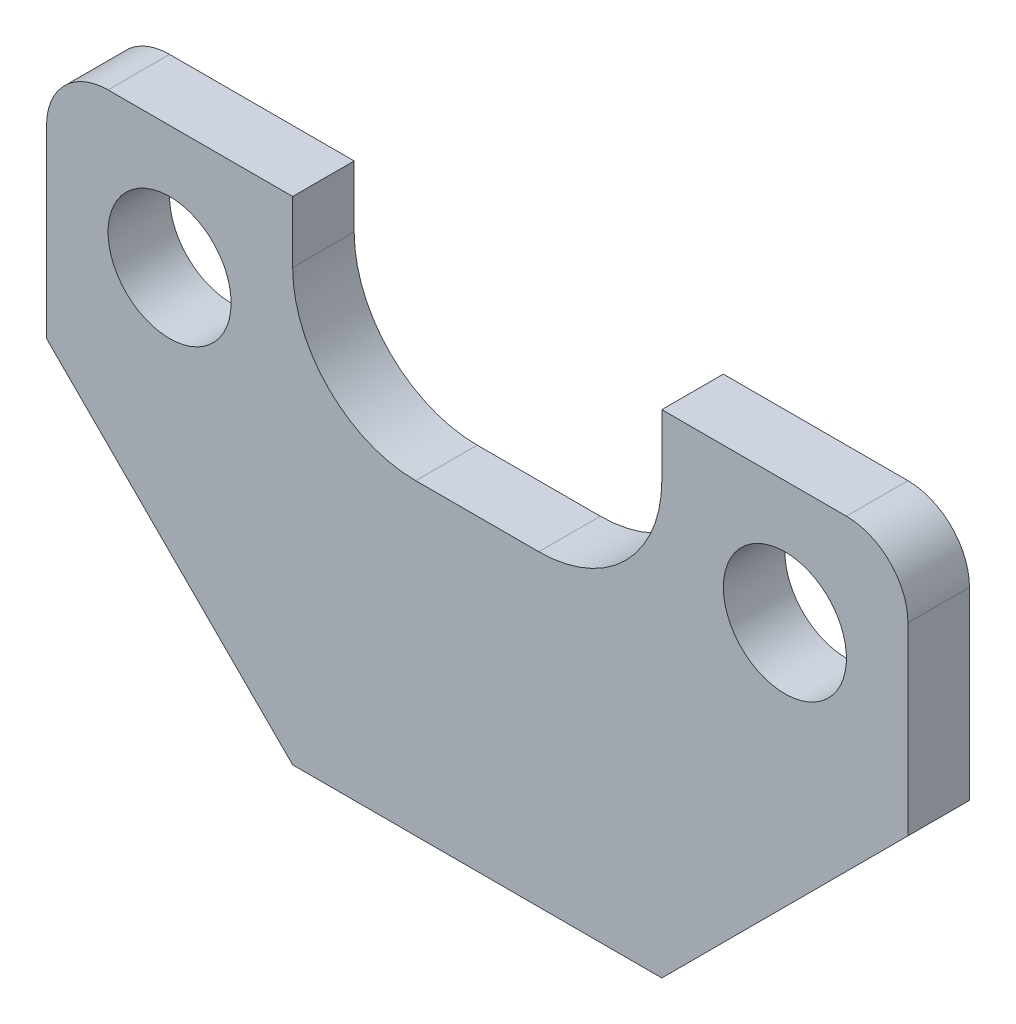
from build123d import *

# Parameters (mm, degrees)
SKETCH1_R           = 5
BOSS_EXTRUDE1_DEPTH = 5
FILLET1_R           = 5


with BuildPart() as part:
    # Sketch1 → Boss-Extrude1 (new body)
    with BuildSketch(Plane.XY):
        with BuildLine():
            Line((0, 0), (30, 0))
            Line((30, 0), (50, 20))
            Line((50, 20), (50, 40))
            Line((50, 40), (30, 40))
            Line((30, 40), (30, 35))
            ThreePointArc((30, 35), (27.071067812, 27.928932188), (20, 25))
            Line((20, 25), (10, 25))
            ThreePointArc((10, 25), (2.928932188, 27.928932188), (0, 35))
            Line((0, 35), (0, 40))
            Line((0, 40), (-20, 40))
            Line((-20, 40), (-20, 20))
            Line((-20, 20), (0, 0))
        make_face()
        with Locations((-10, 30)):
            Circle(SKETCH1_R, mode=Mode.SUBTRACT)
        with Locations(Location((40, 30, 0), (0, 0, 180))):
            Circle(SKETCH1_R, mode=Mode.SUBTRACT)
    extrude(amount=BOSS_EXTRUDE1_DEPTH)

    # Fillet1
    fillet1_edges = [part.edges().sort_by_distance(p)[0] for p in [
        (50, 40, 2.5),
        (-20, 40, 2.5),
    ]]
    fillet(fillet1_edges, radius=FILLET1_R)


solid = part.part
